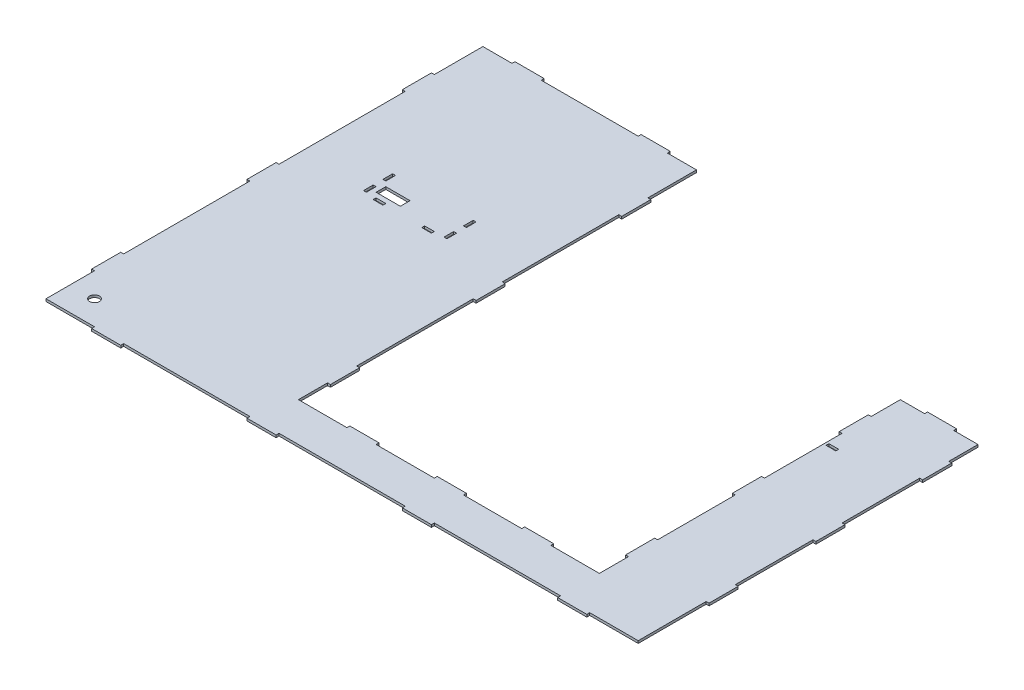
from build123d import *

# Parameters (mm, degrees)
SKETCH1_W           = 3
SKETCH1_H           = 10
SKETCH1_W_2         = 10
SKETCH1_H_2         = 3
BOSS_EXTRUDE1_DEPTH = 2.5
SKETCH2_W           = 10
SKETCH2_H           = 3
CUT_EXTRUDE1_DEPTH  = 10
SKETCH3_R           = 5
SKETCH3_W           = 25
SKETCH3_H           = 10
CUT_EXTRUDE2_DEPTH  = 10


with BuildPart() as part:
    # Sketch1 → Boss-Extrude1 (new body)
    with BuildSketch(Plane(origin=(0, 0, 0), x_dir=(1, 0, 0), z_dir=(0, 1, 0))):
        Polygon((0, 0), (0, 50), (-3, 50), (-3, 80), (0, 80), (0, 210), (-3, 210), (-3, 240), (0, 240), (0, 370), (-3, 370), (-3, 400), (0, 400), (0, 450), (30, 450), (30, 453), (60, 453), (60, 450), (160, 450), (160, 453), (190, 453), (190, 450), (220, 450), (220, 400), (223, 400), (223, 370), (220, 370), (220, 250), (223, 250), (223, 220), (220, 220), (220, 100), (223, 100), (223, 70), (220, 70), (220, 40), (270, 40), (270, 43), (300, 43), (300, 40), (360, 40), (360, 43), (390, 43), (390, 40), (450, 40), (450, 43), (480, 43), (480, 40), (530, 40), (530, 70), (527, 70), (527, 100), (530, 100), (530, 180), (527, 180), (527, 210), (530, 210), (530, 290), (527, 290), (527, 320), (530, 320), (530, 350), (555, 350), (555, 353), (585, 353), (585, 350), (610, 350), (610, 320), (613, 320), (613, 290), (610, 290), (610, 210), (613, 210), (613, 180), (610, 180), (610, 100), (613, 100), (613, 70), (610, 70), (610, 0), (560, 0), (560, -3), (530, -3), (530, 0), (400, 0), (400, -3), (370, -3), (370, 0), (240, 0), (240, -3), (210, -3), (210, 0), (80, 0), (80, -3), (50, -3), (50, 0), align=None)
        with Locations((68.5, 265)):
            Rectangle(SKETCH1_W, SKETCH1_H, mode=Mode.SUBTRACT)
        with Locations((68.5, 285)):
            Rectangle(SKETCH1_W, SKETCH1_H, mode=Mode.SUBTRACT)
        with Locations((85, 258.5)):
            Rectangle(SKETCH1_W_2, SKETCH1_H_2, mode=Mode.SUBTRACT)
        with Locations((135, 258.5)):
            Rectangle(SKETCH1_W_2, SKETCH1_H_2, mode=Mode.SUBTRACT)
        with Locations((151.5, 265)):
            Rectangle(SKETCH1_W, SKETCH1_H, mode=Mode.SUBTRACT)
        with Locations((151.5, 285)):
            Rectangle(SKETCH1_W, SKETCH1_H, mode=Mode.SUBTRACT)
    extrude(amount=BOSS_EXTRUDE1_DEPTH)

    # Sketch2 → Cut-Extrude1 (cut)
    with BuildSketch(Plane(origin=(0, 2.5, 0), x_dir=(1, 0, 0), z_dir=(0, 1, 0))):
        with Locations((537.5, 272.5)):
            Rectangle(SKETCH2_W, SKETCH2_H)
    extrude(amount=-CUT_EXTRUDE1_DEPTH, mode=Mode.SUBTRACT)

    # Sketch3 → Cut-Extrude2 (cut)
    with BuildSketch(Plane.XZ):
        with Locations(Location((25, -25, 0), (0, 0, 270))):
            Circle(SKETCH3_R)
        with Locations((87.5, -270)):
            Rectangle(SKETCH3_W, SKETCH3_H)
    extrude(amount=-CUT_EXTRUDE2_DEPTH, mode=Mode.SUBTRACT)


solid = part.part
